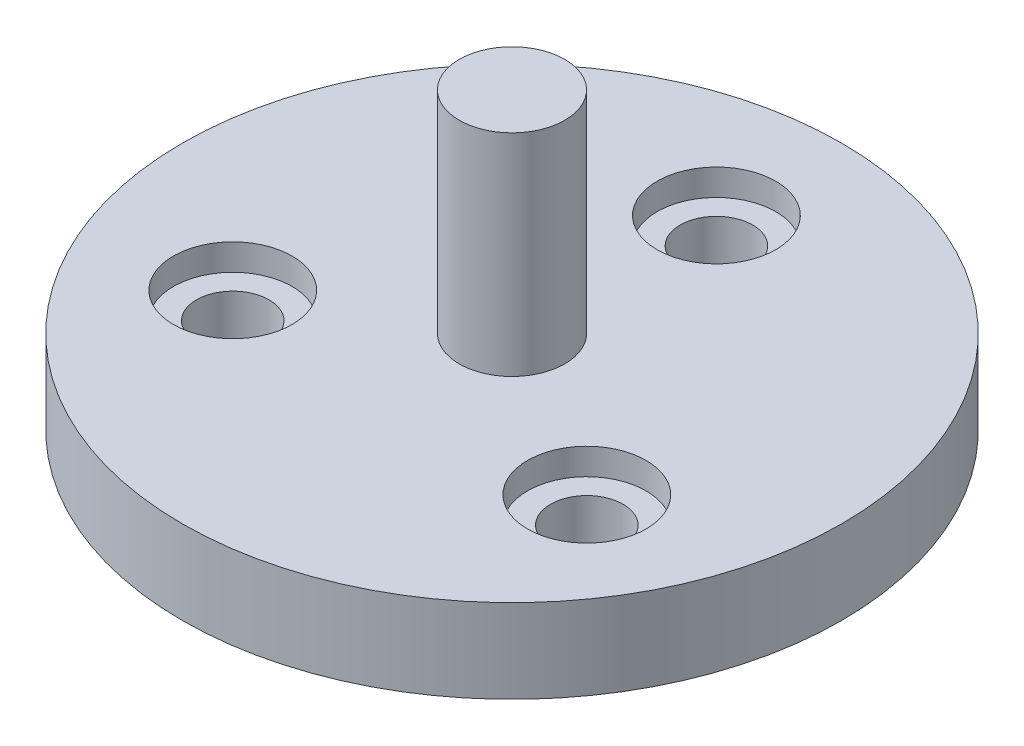
from build123d import *

# Parameters (mm, degrees)
CBORE_FOR_M5_SHCS1_D           = 5.5
CBORE_FOR_M5_SHCS1_CBORE_D     = 9
CBORE_FOR_M5_SHCS1_CBORE_DEPTH = 2


with BuildPart() as part:
    # Sketch1 → Revolve1 (revolve)
    with BuildSketch(Plane(origin=(0, 0, 0), x_dir=(0, 0, -1), z_dir=(1, 0, 0)), mode=Mode.PRIVATE) as revolve1_sk:
        Polygon((0, -6.35), (0, 16), (-4, 16), (-4, 0), (-25, 0), (-25, -6.35), align=None)
    revolve(revolve1_sk.sketch.rotate(Axis((0, -6.35, 0), (0, 1, 0)), 180), axis=Axis((0, -6.35, 0), (0, 1, 0)))

    # CBORE for M5 SHCS1 (through all)
    with Locations(Plane(origin=(0, 0, 0), x_dir=(-1, 0, 0), z_dir=(0, 1, 0))):
        with Locations((0, -15.5), (13.423393759, 7.75), (-13.423393759, 7.75)):
            CounterBoreHole(CBORE_FOR_M5_SHCS1_D / 2, CBORE_FOR_M5_SHCS1_CBORE_D / 2, CBORE_FOR_M5_SHCS1_CBORE_DEPTH)


solid = part.part
